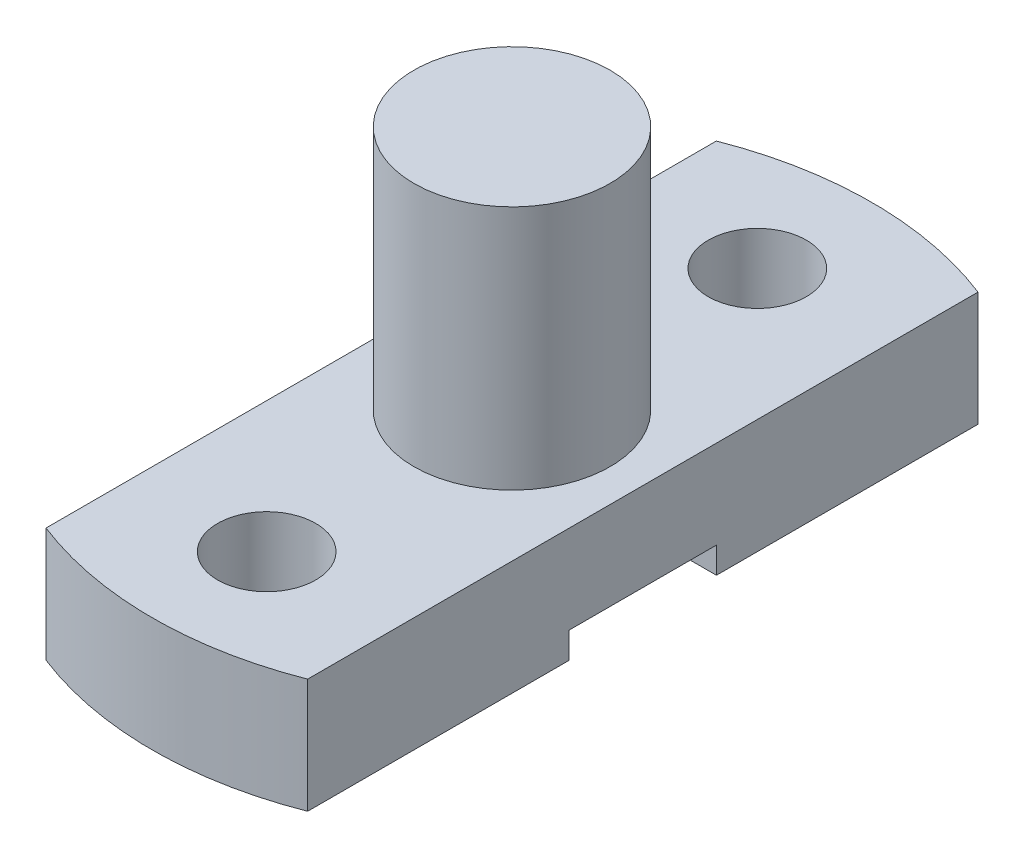
from build123d import *

# Parameters (mm, degrees)
SKETCH1_R           = 15
BOSS_EXTRUDE1_DEPTH = 35
SKETCH2_R           = 30
BOSS_EXTRUDE2_DEPTH = 75
SKETCH4_W           = 45
SKETCH4_H           = 8
CUT_EXTRUDE1_DEPTH  = 175.928556845


with BuildPart() as part:
    # Sketch1 → Boss-Extrude1 (new body)
    with BuildSketch(Plane(origin=(0, 0, 0), x_dir=(1, 0, 0), z_dir=(0, 1, 0))):
        with BuildLine():
            Line((-40, 102.46950766), (-40, -102.46950766))
            ThreePointArc((-40, -102.46950766), (0, -110), (40, -102.46950766))
            Line((40, -102.46950766), (40, 102.46950766))
            ThreePointArc((40, 102.46950766), (0, 110), (-40, 102.46950766))
        make_face()
        with Locations(Location((0, 75, 0), (0, 0, 270))):
            Circle(SKETCH1_R, mode=Mode.SUBTRACT)
        with Locations(Location((0, -75, 0), (0, 0, 270))):
            Circle(SKETCH1_R, mode=Mode.SUBTRACT)
    extrude(amount=BOSS_EXTRUDE1_DEPTH)

    # Sketch2 → Boss-Extrude2 (add)
    with BuildSketch(Plane(origin=(0, 35, 0), x_dir=(1, 0, 0), z_dir=(0, 1, 0))):
        with Locations(Location((0, 0, 0), (0, 0, 270))):
            Circle(SKETCH2_R)
    extrude(amount=BOSS_EXTRUDE2_DEPTH)

    # Sketch4 → Cut-Extrude1 (cut, through all)
    with BuildSketch(Plane(origin=(40, 0, 0), x_dir=(0, 0, -1), z_dir=(1, 0, 0))):
        with Locations((0, 4)):
            Rectangle(SKETCH4_W, SKETCH4_H)
    extrude(amount=-CUT_EXTRUDE1_DEPTH, mode=Mode.SUBTRACT)


solid = part.part
